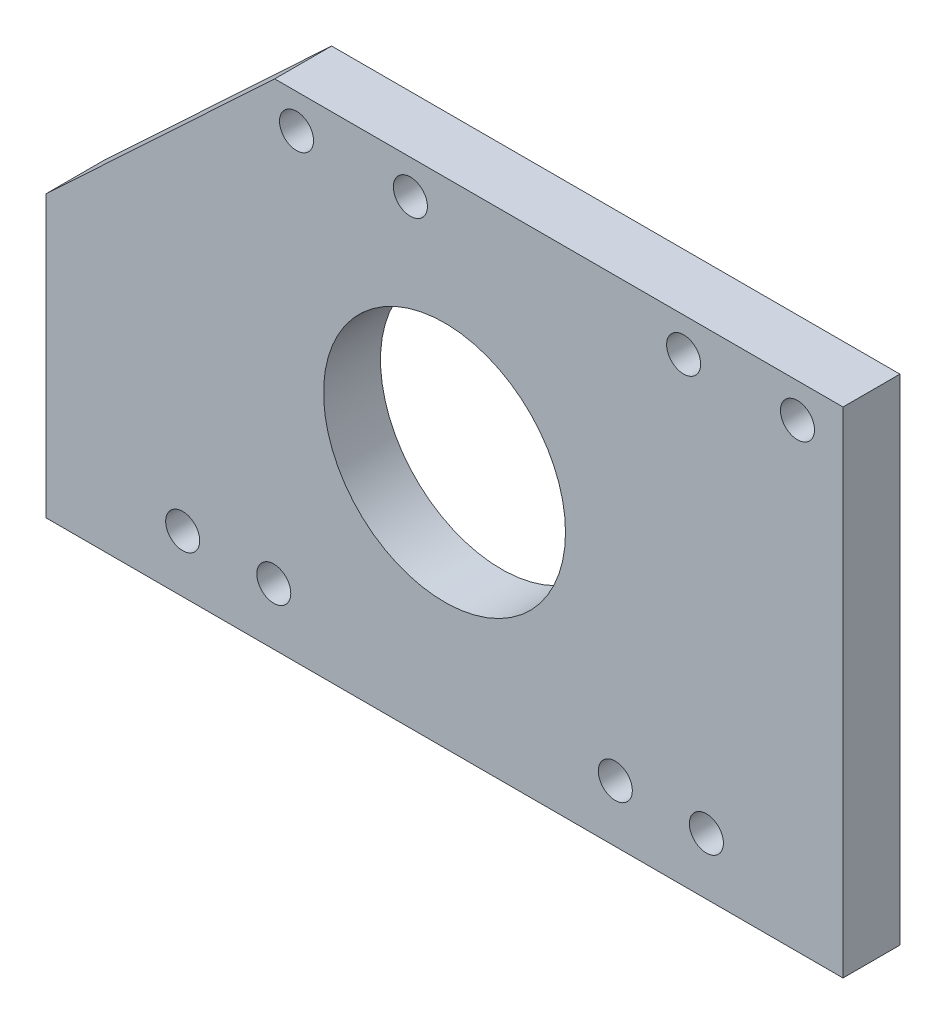
from build123d import *

# Parameters (mm, degrees)
SKETCH1_W             = 254
SKETCH1_H             = 55.16372
SKETCH1_R             = 13.49375
BOSS_EXTRUDE1_DEPTH   = 6.35
F_6_CLEARANCE_HOLE1_D = 3.7973
SKETCH4_W             = 165.1
SKETCH4_H             = 55.16372
CUT_EXTRUDE1_DEPTH    = 6.35
CUT_EXTRUDE2_DEPTH    = 6.35
F_6_CLEARANCE_HOLE2_D = 3.7973


with BuildPart() as part:
    # Sketch1 → Boss-Extrude1 (new body)
    with BuildSketch(Plane.XY):
        Rectangle(SKETCH1_W, SKETCH1_H)
        with Locations((-82.55, 0)):
            Circle(SKETCH1_R, mode=Mode.SUBTRACT)
        with Locations((82.55, 0)):
            Circle(SKETCH1_R, mode=Mode.SUBTRACT)
    extrude(amount=BOSS_EXTRUDE1_DEPTH)

    # #6 Clearance Hole1 (through all)
    with Locations(Plane.XY.offset(6.35)):
        with Locations((-111.76, -21.23186), (-101.6, -21.23186), (-63.5, -21.23186), (-53.34, -21.23186)):
            f_6_clearance_hole1 = Hole(F_6_CLEARANCE_HOLE1_D / 2)

    # Mirror1: #6 Clearance Hole1 across plane
    add(f_6_clearance_hole1.mirror(Plane.ZY), mode=Mode.SUBTRACT)

    # Sketch4 → Cut-Extrude1 (cut)
    with BuildSketch(Plane.XY.offset(6.35)):
        with Locations((44.45, 0)):
            Rectangle(SKETCH4_W, SKETCH4_H)
    extrude(amount=-CUT_EXTRUDE1_DEPTH, mode=Mode.SUBTRACT)

    # Sketch5 → Cut-Extrude2 (cut)
    with BuildSketch(Plane.XY.offset(6.35)):
        Polygon((-127, 3.733618756), (-101.496237284, 27.58186), (-127, 27.58186), align=None)
    extrude(amount=-CUT_EXTRUDE2_DEPTH, mode=Mode.SUBTRACT)

    # #6 Clearance Hole2 (through all)
    with Locations(Plane.XY.offset(6.35)):
        with Locations((-43.18, 23.77186), (-55.88, 23.77186), (-99.06, 23.77186), (-86.36, 23.77186)):
            Hole(F_6_CLEARANCE_HOLE2_D / 2)


solid = part.part
